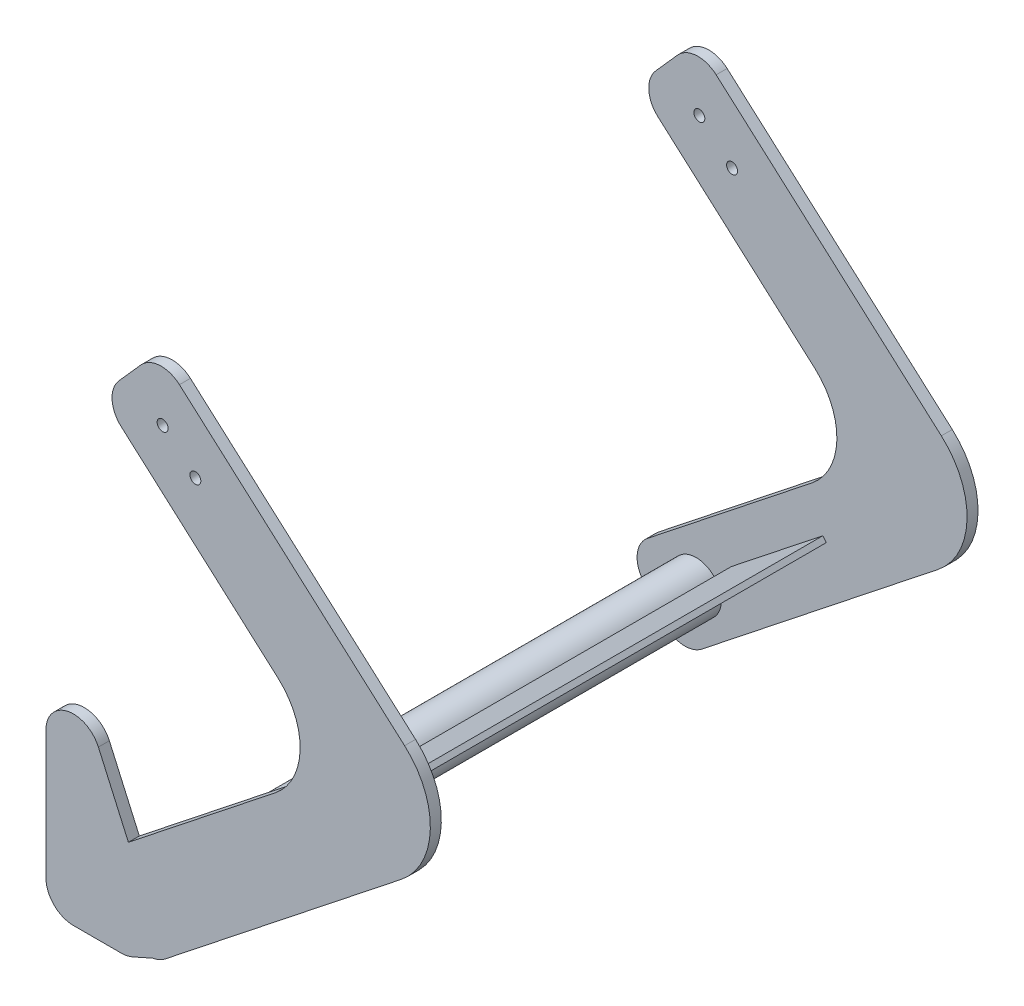
from build123d import *

# Parameters (mm, degrees)
BOSS_EXTRUDE1_DEPTH = 2.54
SKETCH3_R           = 5.824660453
BOSS_EXTRUDE2_DEPTH = 63.5
BOSS_EXTRUDE3_DEPTH = 123.444
SKETCH5_R           = 1.27
CUT_EXTRUDE1_DEPTH  = 189.695241466
BOSS_EXTRUDE5_DEPTH = 2.54


with BuildPart() as part:
    # Sketch2 → Boss-Extrude1 (new body)
    with BuildSketch(Plane.XY):
        with BuildLine():
            Line((30.943753448, 10.972254104), (83.159468074, -35.423237554))
            ThreePointArc((83.159468074, -35.423237554), (89.122580616, -49.217847067), (82.38831151, -62.652860369))
            Line((82.38831151, -62.652860369), (27.63050793, -106.018808383))
            ThreePointArc((27.63050793, -106.018808383), (22.955852809, -107.34845989), (18.710166876, -104.98318515))
            Line((18.710166876, -104.98318515), (13.979336184, -99.009606578))
            ThreePointArc((13.979336184, -99.009606578), (12.649684678, -94.334951456), (15.014959417, -90.089265524))
            Line((15.014959417, -90.089265524), (53.161684307, -59.878614615))
            ThreePointArc((53.161684307, -59.878614615), (58.933914969, -48.362888928), (53.822675647, -36.538937916))
            Line((53.822675647, -36.538937916), (17.446883148, -4.217771969))
            ThreePointArc((17.446883148, -4.217771969), (15.325686693, 0.154973076), (16.917771969, 4.746883148))
            Line((16.917771969, 4.746883148), (21.979098332, 10.443142925))
            ThreePointArc((21.979098332, 10.443142925), (26.351843377, 12.56433938), (30.943753448, 10.972254104))
        make_face()
    boss_extrude1 = extrude(amount=BOSS_EXTRUDE1_DEPTH)

    # Sketch3 → Boss-Extrude2 (add)
    with BuildSketch(Plane.XY.offset(2.54)):
        with Locations((26.300715817, -94.111678043)):
            Circle(SKETCH3_R)
    boss_extrude2 = extrude(amount=-BOSS_EXTRUDE2_DEPTH)

    # Mirror1: Boss-Extrude1, Boss-Extrude2 across plane
    add(boss_extrude1.mirror(Plane(origin=(26.300715817, -94.111678043, -60.96), x_dir=(1, 0, 0), z_dir=(0, 0, 1))))
    add(boss_extrude2.mirror(Plane(origin=(26.300715817, -94.111678043, -60.96), x_dir=(1, 0, 0), z_dir=(0, 0, 1))))

    # Sketch4 → Boss-Extrude3 (add)
    with BuildSketch(Plane(origin=(0, 0, 0), x_dir=(-1, 0, 0), z_dir=(0, 0, -1))):
        Polygon((-35.247552365, -87.026148251), (-34.459080583, -86.030551823), (-55.688722292, -69.2175411), (-56.477194074, -70.213137529), align=None)
    extrude(amount=BOSS_EXTRUDE3_DEPTH)

    # Sketch5 → Cut-Extrude1 (cut, through all)
    with BuildSketch(Plane(origin=(0, 0, 2.54), x_dir=(-1, 0, 0), z_dir=(0, 0, -1))):
        with Locations(Location((-27.043448187, 0.846577886, 0), (0, 0, 180))):
            Circle(SKETCH5_R)
        with Locations(Location((-34.638461223, -5.901857264, 0), (0, 0, 180))):
            Circle(SKETCH5_R)
    extrude(amount=CUT_EXTRUDE1_DEPTH, mode=Mode.SUBTRACT)

    # Sketch7 → Boss-Extrude5 (add)
    with BuildSketch(Plane.XY.offset(2.54)):
        with BuildLine():
            Line((27.63050793, -106.018808383), (20.056626411, -109.386083488))
            ThreePointArc((20.056626411, -109.386083488), (18.795524409, -109.795283294), (17.476939915, -109.933694534))
            Line((17.476939915, -109.933694534), (6.35, -109.933694534))
            ThreePointArc((6.35, -109.933694534), (1.859871939, -108.073822594), (0, -103.583694534))
            Line((0, -103.583694534), (0, -73.78416115))
            ThreePointArc((0, -73.78416115), (5.031415506, -67.57257239), (12.152388955, -71.204474655))
            Line((12.152388955, -71.204474655), (27.63050793, -106.018808383))
        make_face()
    extrude(amount=-BOSS_EXTRUDE5_DEPTH)


solid = part.part
